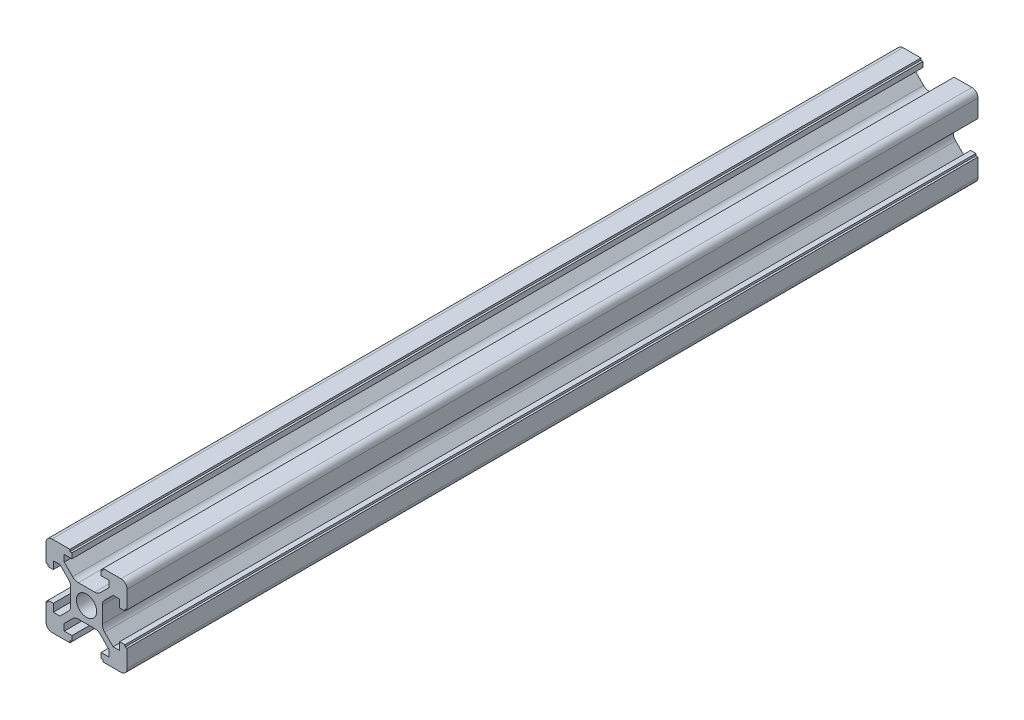
from build123d import *

# Parameters (mm, degrees)
SKETCH1_R           = 2.5
BOSS_EXTRUDE2_DEPTH = 210


with BuildPart() as part:
    # Sketch1 → Boss-Extrude2 (new body)
    with BuildSketch(Plane.XY):
        with BuildLine():
            Line((10, -4.1), (10, -8.5))
            ThreePointArc((10, -8.5), (9.560660172, -9.560660172), (8.5, -10))
            Line((8.5, -10), (4.1, -10))
            Line((4.1, -10), (4.1, -9.5))
            Line((4.1, -9.5), (3.6, -9.5))
            Line((3.6, -9.5), (3.6, -8.2))
            Line((3.6, -8.2), (5.5, -8.2))
            Line((5.5, -8.2), (5.5, -6.560660172))
            Line((5.5, -6.560660172), (3.425126266, -4.485786438))
            ThreePointArc((3.425126266, -4.485786438), (2.776279568, -4.052240935), (2.010912703, -3.9))
            Line((2.010912703, -3.9), (-2.010912703, -3.9))
            ThreePointArc((-2.010912703, -3.9), (-2.776279568, -4.052240935), (-3.425126266, -4.485786438))
            Line((-3.425126266, -4.485786438), (-5.5, -6.560660172))
            Line((-5.5, -6.560660172), (-5.5, -8.2))
            Line((-5.5, -8.2), (-3.6, -8.2))
            Line((-3.6, -8.2), (-3.6, -9.5))
            Line((-3.6, -9.5), (-4.1, -9.5))
            Line((-4.1, -9.5), (-4.1, -10))
            Line((-4.1, -10), (-8.5, -10))
            ThreePointArc((-8.5, -10), (-9.560660172, -9.560660172), (-10, -8.5))
            Line((-10, -8.5), (-10, -4.1))
            Line((-10, -4.1), (-9.5, -4.1))
            Line((-9.5, -4.1), (-9.5, -3.6))
            Line((-9.5, -3.6), (-8.2, -3.6))
            Line((-8.2, -3.6), (-8.2, -5.5))
            Line((-8.2, -5.5), (-6.560660172, -5.5))
            Line((-6.560660172, -5.5), (-4.485786438, -3.425126266))
            ThreePointArc((-4.485786438, -3.425126266), (-4.052240935, -2.776279568), (-3.9, -2.010912703))
            Line((-3.9, -2.010912703), (-3.9, 2.010912703))
            ThreePointArc((-3.9, 2.010912703), (-4.052240935, 2.776279568), (-4.485786438, 3.425126266))
            Line((-4.485786438, 3.425126266), (-6.560660172, 5.5))
            Line((-6.560660172, 5.5), (-8.2, 5.5))
            Line((-8.2, 5.5), (-8.2, 3.6))
            Line((-8.2, 3.6), (-9.5, 3.6))
            Line((-9.5, 3.6), (-9.5, 4.1))
            Line((-9.5, 4.1), (-10, 4.1))
            Line((-10, 4.1), (-10, 8.5))
            ThreePointArc((-10, 8.5), (-9.560660172, 9.560660172), (-8.5, 10))
            Line((-8.5, 10), (-4.1, 10))
            Line((-4.1, 10), (-4.1, 9.5))
            Line((-4.1, 9.5), (-3.6, 9.5))
            Line((-3.6, 9.5), (-3.6, 8.2))
            Line((-3.6, 8.2), (-5.5, 8.2))
            Line((-5.5, 8.2), (-5.5, 6.560660172))
            Line((-5.5, 6.560660172), (-3.425126266, 4.485786438))
            ThreePointArc((-3.425126266, 4.485786438), (-2.776279568, 4.052240935), (-2.010912703, 3.9))
            Line((-2.010912703, 3.9), (2.010912703, 3.9))
            ThreePointArc((2.010912703, 3.9), (2.776279568, 4.052240935), (3.425126266, 4.485786438))
            Line((3.425126266, 4.485786438), (5.5, 6.560660172))
            Line((5.5, 6.560660172), (5.5, 8.2))
            Line((5.5, 8.2), (3.6, 8.2))
            Line((3.6, 8.2), (3.6, 9.5))
            Line((3.6, 9.5), (4.1, 9.5))
            Line((4.1, 9.5), (4.1, 10))
            Line((4.1, 10), (8.5, 10))
            ThreePointArc((8.5, 10), (9.560660172, 9.560660172), (10, 8.5))
            Line((10, 8.5), (10, 4.1))
            Line((10, 4.1), (9.5, 4.1))
            Line((9.5, 4.1), (9.5, 3.6))
            Line((9.5, 3.6), (8.2, 3.6))
            Line((8.2, 3.6), (8.2, 5.5))
            Line((8.2, 5.5), (6.560660172, 5.5))
            Line((6.560660172, 5.5), (4.485786438, 3.425126266))
            ThreePointArc((4.485786438, 3.425126266), (4.052240935, 2.776279568), (3.9, 2.010912703))
            Line((3.9, 2.010912703), (3.9, -2.010912703))
            ThreePointArc((3.9, -2.010912703), (4.052240935, -2.776279568), (4.485786438, -3.425126266))
            Line((4.485786438, -3.425126266), (6.560660172, -5.5))
            Line((6.560660172, -5.5), (8.2, -5.5))
            Line((8.2, -5.5), (8.2, -3.6))
            Line((8.2, -3.6), (9.5, -3.6))
            Line((9.5, -3.6), (9.5, -4.1))
            Line((9.5, -4.1), (10, -4.1))
        make_face()
        Circle(SKETCH1_R, mode=Mode.SUBTRACT)
    extrude(amount=BOSS_EXTRUDE2_DEPTH)


solid = part.part
